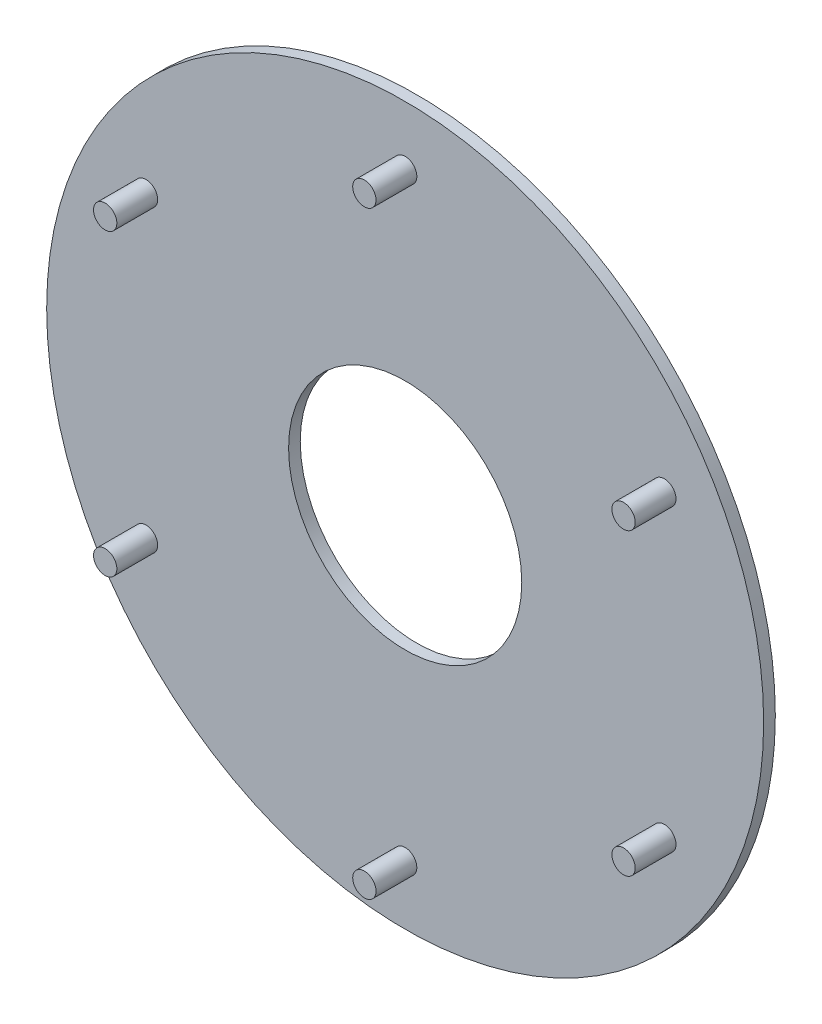
from build123d import *

# Parameters (mm, degrees)
SKETCH1_R           = 61.5
BOSS_EXTRUDE1_DEPTH = 2
SKETCH2_R           = 2
BOSS_EXTRUDE2_DEPTH = 7
CIRPATTERN1_COUNT   = 6
SKETCH1_3_R         = 20
CUT_EXTRUDE1_DEPTH  = 88.255372327


with BuildPart() as part:
    # Sketch1 → Boss-Extrude1 (new body)
    with BuildSketch(Plane.XY):
        Circle(SKETCH1_R)
    extrude(amount=-BOSS_EXTRUDE1_DEPTH)

    # Sketch2 → Boss-Extrude2 (add)
    with BuildSketch(Plane.XY):
        with Locations((0, 51.338311715)):
            Circle(SKETCH2_R)
    boss_extrude2 = extrude(amount=BOSS_EXTRUDE2_DEPTH)

    # CirPattern1: Boss-Extrude2 ×6 about axis
    cirpattern1_axis = Axis((0, 0, 0), (0, 0, -1))
    for i in range(1, CIRPATTERN1_COUNT):
        add(boss_extrude2.rotate(cirpattern1_axis, i * 360 / CIRPATTERN1_COUNT))

    # Sketch1<3> → Cut-Extrude1 (cut, through all)
    with BuildSketch(Plane.XY):
        Circle(SKETCH1_3_R)
    extrude(amount=-CUT_EXTRUDE1_DEPTH, mode=Mode.SUBTRACT)


solid = part.part
